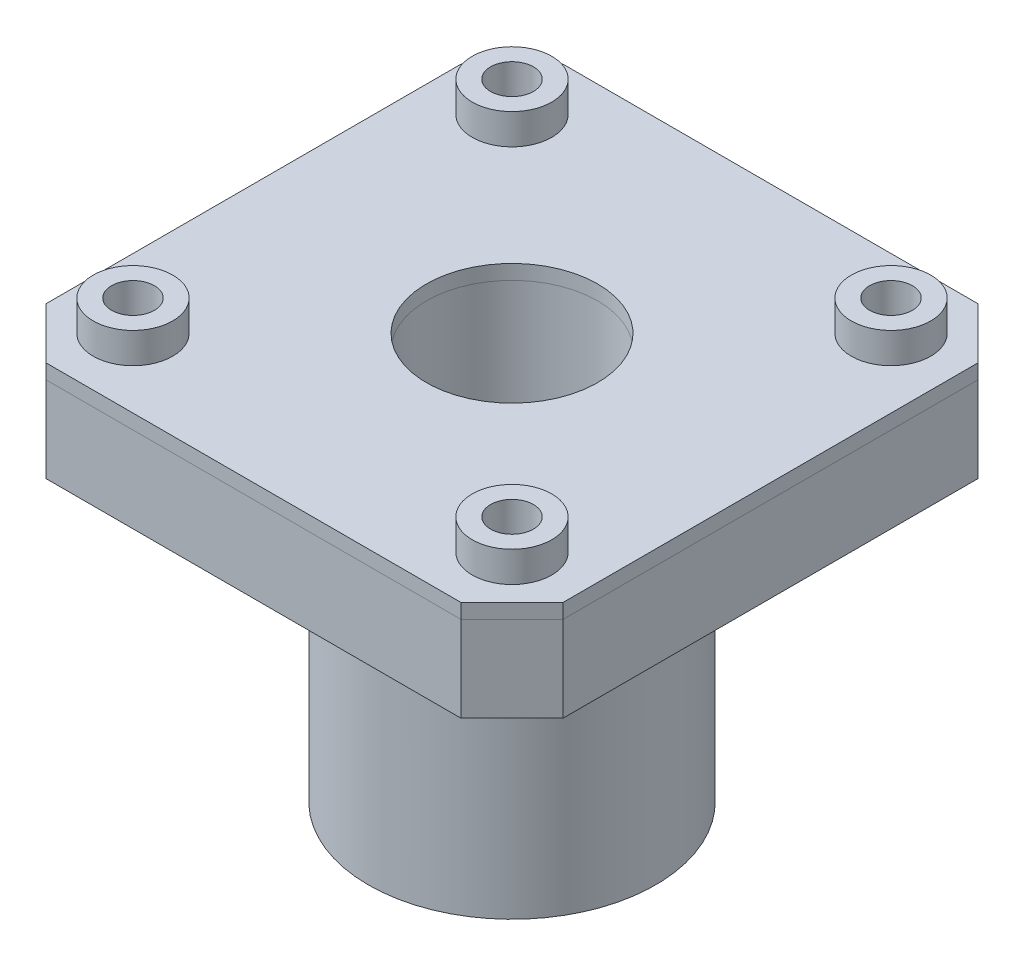
from build123d import *

# Parameters (mm, degrees)
SKETCH1_W               = 42.3
SKETCH1_H               = 42.3
BOSS_EXTRUDE1_DEPTH     = 8.2
CUT_EXTRUDE3_DEPTH      = 32.014270909
SKETCH6_R               = 3.25
BOSS_EXTRUDE2_DEPTH     = 2.5
SKETCH7_R               = 1.75
CUT_EXTRUDE6_DEPTH      = 32.766885274
SKETCH10_R              = 3
CUT_EXTRUDE9_DEPTH      = 3.25
MIRROR5_COPY_1_SKETCH_R = 3.25
MIRROR5_COPY_1_DEPTH    = 2.5
MIRROR5_COPY_2_SKETCH_R = 1.75
MIRROR5_COPY_2_DEPTH    = 32.766885274
MIRROR5_COPY_3_SKETCH_R = 3
MIRROR5_COPY_3_DEPTH    = 3.25
SKETCH11_R              = 11.75
BOSS_EXTRUDE3_DEPTH     = 25
CUT_EXTRUDE10_START     = -1
CUT_EXTRUDE10_DEPTH     = 6.2
SKETCH8_R               = 7
CUT_EXTRUDE11_DEPTH     = 47.573973419


with BuildPart() as part:
    # Sketch1 → Boss-Extrude1 (new body)
    with BuildSketch(Plane(origin=(0, 0, 0), x_dir=(1, 0, 0), z_dir=(0, 1, 0))):
        Rectangle(SKETCH1_W, SKETCH1_H)
    extrude(amount=BOSS_EXTRUDE1_DEPTH)

    # Sketch4 → Cut-Extrude3 (cut, symmetric)
    with BuildSketch(Plane(origin=(0, 0, 0), x_dir=(1, 0, 0), z_dir=(0, 1, 0))):
        Polygon((-21.15, 16.963055506), (-16.963055506, 21.15), (-21.15, 21.15), align=None)
        Polygon((16.963055506, -21.15), (21.15, -16.963055506), (21.15, -21.15), align=None)
    cut_extrude3 = extrude(amount=CUT_EXTRUDE3_DEPTH, both=True, mode=Mode.SUBTRACT)

    # Mirror1: Cut-Extrude3 across plane
    add(cut_extrude3.mirror(Plane.XY), mode=Mode.SUBTRACT)

    # Sketch6 → Boss-Extrude2 (add)
    with BuildSketch(Plane(origin=(0, 8.2, 0), x_dir=(1, 0, 0), z_dir=(0, 1, 0))):
        with Locations(Location((-15.5, 15.5, 0), (0, 0, 270))):
            Circle(SKETCH6_R)
    boss_extrude2 = extrude(amount=BOSS_EXTRUDE2_DEPTH)

    # Sketch7 → Cut-Extrude6 (cut, through all)
    with BuildSketch(Plane(origin=(0, 0, 0), x_dir=(1, 0, 0), z_dir=(0, 1, 0))):
        with Locations(Location((-15.5, 15.5, 0), (0, 0, 270))):
            Circle(SKETCH7_R)
    cut_extrude6 = extrude(amount=CUT_EXTRUDE6_DEPTH, mode=Mode.SUBTRACT)

    # Sketch10 → Cut-Extrude9 (cut)
    with BuildSketch(Plane(origin=(0, 0, 0), x_dir=(-1, 0, 0), z_dir=(0, 1, 0))):
        with Locations(Location((15.5, -15.5, 0), (0, 0, 270))):
            Circle(SKETCH10_R)
    cut_extrude9 = extrude(amount=CUT_EXTRUDE9_DEPTH, mode=Mode.SUBTRACT)

    # Mirror4: Boss-Extrude2, Cut-Extrude6, Cut-Extrude9 across plane
    add(boss_extrude2.mirror(Plane(origin=(0, 0, 0), x_dir=(0, 0, 1), z_dir=(1, 0, 0))))
    add(cut_extrude6.mirror(Plane(origin=(0, 0, 0), x_dir=(0, 0, 1), z_dir=(1, 0, 0))), mode=Mode.SUBTRACT)
    add(cut_extrude9.mirror(Plane(origin=(0, 0, 0), x_dir=(0, 0, 1), z_dir=(1, 0, 0))), mode=Mode.SUBTRACT)

    # Mirror5: Boss-Extrude2, Cut-Extrude6, Cut-Extrude9 across plane
    add(boss_extrude2.mirror(Plane.XY))
    add(cut_extrude6.mirror(Plane.XY), mode=Mode.SUBTRACT)
    add(cut_extrude9.mirror(Plane.XY), mode=Mode.SUBTRACT)

    # Mirror5 copy 1 sketch → Mirror5 copy 1 (add)
    with BuildSketch(Plane(origin=(0, 8.2, 0), x_dir=(-1, 0, 0), z_dir=(0, 1, 0))):
        with Locations(Location((-15.5, 15.5, 0), (0, 0, 270))):
            Circle(MIRROR5_COPY_1_SKETCH_R)
    extrude(amount=MIRROR5_COPY_1_DEPTH)

    # Mirror5 copy 2 sketch → Mirror5 copy 2 (cut, through all)
    with BuildSketch(Plane(origin=(0, 0, 0), x_dir=(-1, 0, 0), z_dir=(0, 1, 0))):
        with Locations(Location((-15.5, 15.5, 0), (0, 0, 270))):
            Circle(MIRROR5_COPY_2_SKETCH_R)
    extrude(amount=MIRROR5_COPY_2_DEPTH, mode=Mode.SUBTRACT)

    # Mirror5 copy 3 sketch → Mirror5 copy 3 (cut)
    with BuildSketch(Plane(origin=(0, 0, 0), x_dir=(1, 0, 0), z_dir=(0, 1, 0))):
        with Locations(Location((15.5, -15.5, 0), (0, 0, 270))):
            Circle(MIRROR5_COPY_3_SKETCH_R)
    extrude(amount=MIRROR5_COPY_3_DEPTH, mode=Mode.SUBTRACT)

    # Sketch11 → Boss-Extrude3 (add)
    with BuildSketch(Plane.XZ):
        with Locations(Location((0, 0, 0), (0, 0, 90))):
            Circle(SKETCH11_R)
    extrude(amount=BOSS_EXTRUDE3_DEPTH)

    # Sketch2 → Cut-Extrude10 (cut)
    with BuildSketch(Plane(origin=(0, -25, 0), x_dir=(-1, 0, 0), z_dir=(0, -1, 0)).offset(CUT_EXTRUDE10_START)):
        Polygon((11.085125168, 0), (5.542562584, 9.6), (-5.542562584, 9.6), (-11.085125168, 0), (-5.542562584, -9.6), (5.542562584, -9.6), align=None)
    extrude(amount=-CUT_EXTRUDE10_DEPTH, mode=Mode.SUBTRACT)

    # Sketch8 → Cut-Extrude11 (cut, through all)
    with BuildSketch(Plane(origin=(0, -25, 0), x_dir=(1, 0, 0), z_dir=(0, 1, 0))):
        with Locations(Location((0, 0, 0), (0, 0, 90))):
            Circle(SKETCH8_R)
    extrude(amount=CUT_EXTRUDE11_DEPTH, mode=Mode.SUBTRACT)


with BuildPart() as body_2:
    # Split1: the piece on the far side of the plane
    add(part.part)
    split(bisect_by=Plane(origin=(0, 7, 0), x_dir=(0, 0, -1), z_dir=(0, -1, 0)), keep=Keep.BOTTOM)


with BuildPart() as part_1:
    add(part.part)

    # Split1
    split(bisect_by=Plane(origin=(0, 7, 0), x_dir=(0, 0, -1), z_dir=(0, -1, 0)), keep=Keep.TOP)


solid = Compound([body_2.part, part_1.part])
